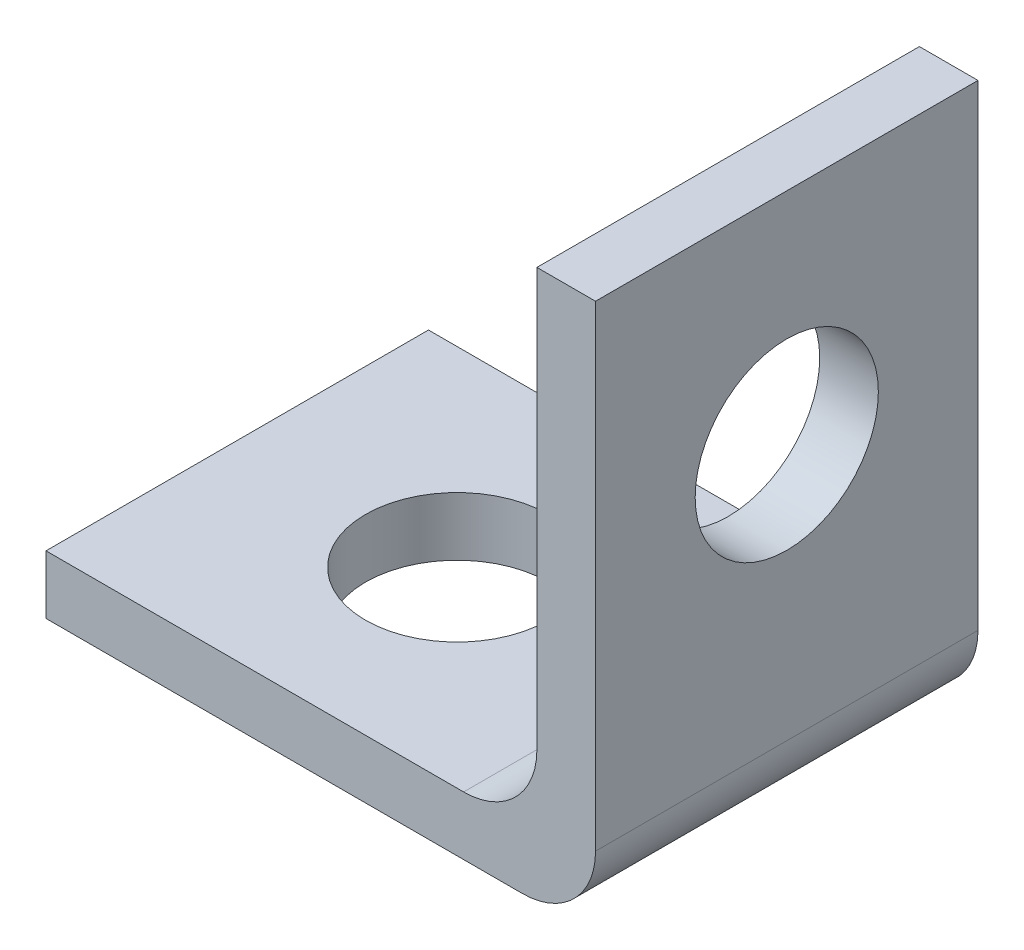
from build123d import *

# Parameters (mm, degrees)
BOSS_EXTRUDE1_DEPTH        = 6.6294
BOSS_EXTRUDE1_DEPTH_BACK   = 6.6294
F_1_4_0_2500_DOWEL_HOLE1_D = 6.35
F_1_4_0_2500_DOWEL_HOLE2_D = 6.35
FILLET1_R                  = 2.54


with BuildPart() as part:
    # Sketch1 → Boss-Extrude1 (new, two sides: drawn at the far end of the back side and taken through both)
    with BuildSketch(Plane.XY.offset(-BOSS_EXTRUDE1_DEPTH_BACK)):
        Polygon((7.493, 1.016), (7.493, 18.034), (9.525, 18.034), (9.525, -1.016), (-9.525, -1.016), (-9.525, 1.016), align=None)
    extrude(amount=BOSS_EXTRUDE1_DEPTH + BOSS_EXTRUDE1_DEPTH_BACK)

    # 1/4 (0.2500) Dowel Hole1 (through all)
    with Locations(Plane(origin=(0, 1.016, 0), x_dir=(1, 0, 0), z_dir=(0, 1, 0))):
        with Locations((-1.905, 0)):
            Hole(F_1_4_0_2500_DOWEL_HOLE1_D / 2)

    # 1/4 (0.2500) Dowel Hole2 (through all)
    with Locations(Plane.ZY.offset(-7.493)):
        with Locations((0, 10.414)):
            Hole(F_1_4_0_2500_DOWEL_HOLE2_D / 2)

    # Fillet1
    fillet1_edges = [part.edges().sort_by_distance(p)[0] for p in [
        (7.493, 1.016, 0),
        (9.525, -1.016, 0),
    ]]
    fillet(fillet1_edges, radius=FILLET1_R)


solid = part.part
